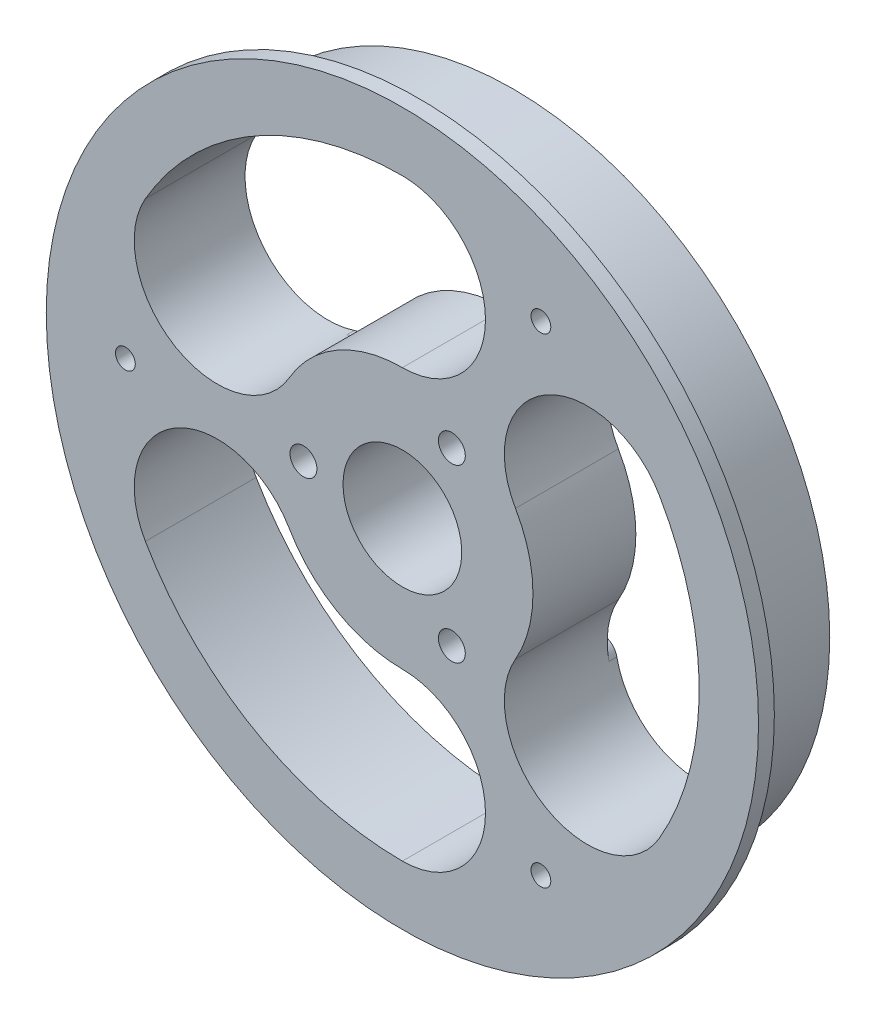
from build123d import *

# Parameters (mm, degrees)
SKETCH_1_R          = 40
EXTRUDE_1_DEPTH     = 12
SKETCH_8_R          = 45
EXTRUDE_3_DEPTH     = 2
SKETCH_2_R          = 7.5
CUT_EXTRUDE_1_DEPTH = 66.161338231
HOLE_WIZARD_M32_D   = 3.4
CUT_EXTRUDE_2_DEPTH = 66.161338231
M3X0_51_D           = 2.5
SKETCH_18_R         = 17.5
CUT_EXTRUDE_4_DEPTH = 1
FILLET_1_R          = 2


with BuildPart() as part:
    # Эскиз1 → Бобышка-Вытянуть1 (new body)
    with BuildSketch(Plane.XY):
        Circle(SKETCH_1_R)
    extrude(amount=EXTRUDE_1_DEPTH)

    # Эскиз8 → Бобышка-Вытянуть3 (add)
    with BuildSketch(Plane.XY.offset(12)):
        Circle(SKETCH_8_R)
    extrude(amount=EXTRUDE_3_DEPTH)

    # Эскиз2 → Вырез-Вытянуть1 (cut, through all)
    with BuildSketch(Plane(origin=(0, 0, 14), x_dir=(-1, 0, 0), z_dir=(0, 0, -1))):
        Circle(SKETCH_2_R)
    extrude(amount=CUT_EXTRUDE_1_DEPTH, mode=Mode.SUBTRACT)

    # Отверстие с зазором M32 (through all)
    with Locations(Plane.XY.offset(14)):
        with Locations((6.25, 10.825317547), (-12.5, 0), (6.25, -10.825317547)):
            Hole(HOLE_WIZARD_M32_D / 2)

    # Эскиз10 → Вырез-Вытянуть2 (cut, through all)
    with BuildSketch(Plane(origin=(0, 0, 0), x_dir=(-1, 0, 0), z_dir=(0, 0, -1))):
        with BuildLine():
            ThreePointArc((32.475952642, -18.75), (28.632685902, -4.40673326), (14.289419162, -8.25))
            ThreePointArc((14.289419162, -8.25), (8.25, -14.289419162), (0, -16.5))
            ThreePointArc((0, -16.5), (-10.5, -27), (0, -37.5))
            ThreePointArc((0, -37.5), (18.75, -32.475952642), (32.475952642, -18.75))
        make_face()
        with BuildLine():
            ThreePointArc((32.475952642, 18.75), (18.75, 32.475952642), (0, 37.5))
            ThreePointArc((0, 37.5), (-10.5, 27), (0, 16.5))
            ThreePointArc((0, 16.5), (8.25, 14.289419162), (14.289419162, 8.25))
            ThreePointArc((14.289419162, 8.25), (28.632685902, 4.40673326), (32.475952642, 18.75))
        make_face()
        with BuildLine():
            ThreePointArc((-32.475952642, -18.75), (-18.132685902, -22.59326674), (-14.289419162, -8.25))
            ThreePointArc((-14.289419162, -8.25), (-16.5, 0), (-14.289419162, 8.25))
            ThreePointArc((-14.289419162, 8.25), (-18.132685902, 22.59326674), (-32.475952642, 18.75))
            ThreePointArc((-32.475952642, 18.75), (-37.5, 0), (-32.475952642, -18.75))
        make_face()
    extrude(amount=-CUT_EXTRUDE_2_DEPTH, mode=Mode.SUBTRACT)

    # Отверстие обработанное метчиком M3x0.51 (through all)
    with Locations(Plane(origin=(0, 0, 0), x_dir=(-1, 0, 0), z_dir=(0, 0, -1))):
        with Locations((-17.5, 30.310889132), (35, 0), (-17.5, -30.310889132)):
            Hole(M3X0_51_D / 2)

    # Эскиз18 → Вырез-Вытянуть4 (cut)
    with BuildSketch(Plane(origin=(0, 0, 0), x_dir=(-1, 0, 0), z_dir=(0, 0, -1))):
        Circle(SKETCH_18_R)
    extrude(amount=-CUT_EXTRUDE_4_DEPTH, mode=Mode.SUBTRACT)

    # Скругление1
    fillet_1_edges = [part.edges().sort_by_distance(p)[0] for p in [
        (3.581311038, 17.12962963, 0.5),
        (-16.625349936, 5.463308477, 0.5),
        (-16.625349936, -5.463308477, 0.5),
        (3.581311038, -17.12962963, 0.5),
        (13.044038898, -11.666321153, 0.5),
        (13.044038898, 11.666321153, 0.5),
    ]]
    fillet(fillet_1_edges, radius=FILLET_1_R)


solid = part.part
